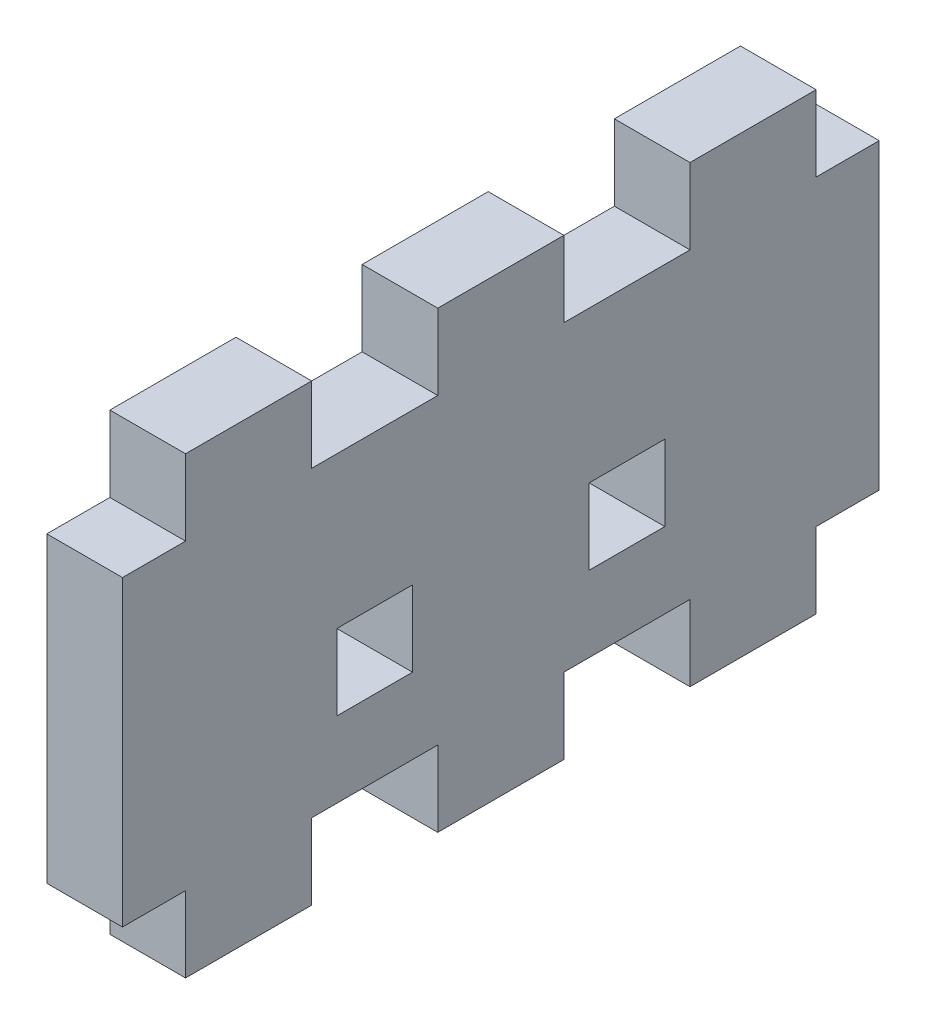
from build123d import *

# Parameters (mm, degrees)
SKETCH1_W           = 30
SKETCH1_H           = 12
BOSS_EXTRUDE1_DEPTH = 3
SKETCH3_W           = 5
SKETCH3_H           = 3
BOSS_EXTRUDE2_DEPTH = 3
SKETCH4_W           = 3
SKETCH4_H           = 3
CUT_EXTRUDE1_DEPTH  = 10


with BuildPart() as part:
    # Sketch1 → Boss-Extrude1 (new body)
    with BuildSketch(Plane(origin=(0, 0, 0), x_dir=(0, 0, -1), z_dir=(1, 0, 0))):
        Rectangle(SKETCH1_W, SKETCH1_H)
    extrude(amount=BOSS_EXTRUDE1_DEPTH)

    # Sketch3 → Boss-Extrude2 (add)
    with BuildSketch(Plane(origin=(3, 0, 0), x_dir=(0, 0, -1), z_dir=(1, 0, 0))):
        with Locations((-10, 7.5)):
            Rectangle(SKETCH3_W, SKETCH3_H)
        with Locations((0, 7.5)):
            Rectangle(SKETCH3_W, SKETCH3_H)
        with Locations((10, 7.5)):
            Rectangle(SKETCH3_W, SKETCH3_H)
        with Locations((10, -7.5)):
            Rectangle(SKETCH3_W, SKETCH3_H)
        with Locations((0, -7.5)):
            Rectangle(SKETCH3_W, SKETCH3_H)
        with Locations((-10, -7.5)):
            Rectangle(SKETCH3_W, SKETCH3_H)
    extrude(amount=-BOSS_EXTRUDE2_DEPTH)

    # Sketch4 → Cut-Extrude1 (cut)
    with BuildSketch(Plane(origin=(3, 0, 0), x_dir=(0, 0, -1), z_dir=(1, 0, 0))):
        with Locations((-5, -1.5)):
            Rectangle(SKETCH4_W, SKETCH4_H)
        with Locations((5, -1.5)):
            Rectangle(SKETCH4_W, SKETCH4_H)
    extrude(amount=-CUT_EXTRUDE1_DEPTH, mode=Mode.SUBTRACT)


solid = part.part
